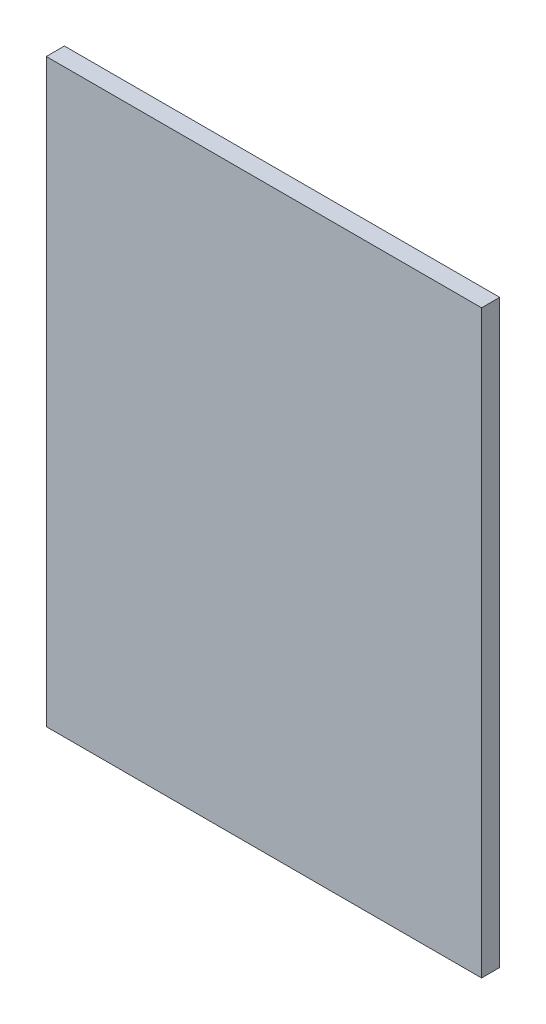
from build123d import *

# Parameters (mm, degrees)
SKETCH1_W           = 304.8
SKETCH1_H           = 406.4
BOSS_EXTRUDE1_DEPTH = 12.7


with BuildPart() as part:
    # Sketch1 → Boss-Extrude1 (new body)
    with BuildSketch(Plane.XY):
        with Locations((152.4, 203.2)):
            Rectangle(SKETCH1_W, SKETCH1_H)
    extrude(amount=BOSS_EXTRUDE1_DEPTH)


solid = part.part
